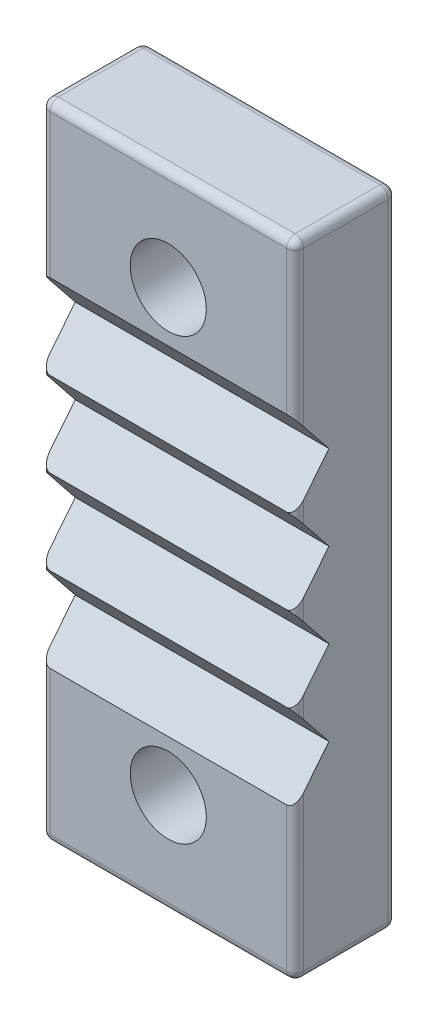
from build123d import *

# Parameters (mm, degrees)
SKETCH_1_W             = 15
SKETCH_1_H             = 38
SKETCH_1_R             = 2.25
EXTRUDE_1_DEPTH        = 3
FILLET_1_R             = 0.5
CUT_EXTRUDE_1_DEPTH    = 7.5
PATTERN_LINEAR_1_COUNT = 4
PATTERN_LINEAR_1_PITCH = 5


with BuildPart() as part:
    # 草图1 → 凸台-拉伸1 (new, symmetric)
    with BuildSketch(Plane.XY):
        Rectangle(SKETCH_1_W, SKETCH_1_H)
        with Locations((0, 13)):
            Circle(SKETCH_1_R, mode=Mode.SUBTRACT)
        with Locations((0, -13)):
            Circle(SKETCH_1_R, mode=Mode.SUBTRACT)
    extrude(amount=EXTRUDE_1_DEPTH, both=True)

    # 圆角1
    fillet_1_edges = [part.edges().sort_by_distance(p)[0] for p in [
        (-7.5, 0, 3),
        (0, -19, 3),
        (7.5, 0, 3),
        (0, -19, -3),
        (-7.5, 0, -3),
        (0, 19, -3),
        (7.5, 0, -3),
        (7.5, -19, 0),
        (-7.5, -19, 0),
        (-7.5, 19, 0),
        (7.5, 19, 0),
        (0, 19, 3),
    ]]
    fillet(fillet_1_edges, radius=FILLET_1_R)

    # 草图2 → 切除-拉伸1 (cut, symmetric)
    with BuildSketch(Plane(origin=(0, 0, 0), x_dir=(0, 0, -1), z_dir=(1, 0, 0))):
        Polygon((-3, 10), (-1, 7.5), (-3, 5), align=None)
    cut_extrude_1 = extrude(amount=CUT_EXTRUDE_1_DEPTH, both=True, mode=Mode.SUBTRACT)

    # 阵列(线性)1: 切除-拉伸1 ×4
    with Locations(*[(0, -i * PATTERN_LINEAR_1_PITCH, 0) for i in range(1, PATTERN_LINEAR_1_COUNT)]):
        add(cut_extrude_1, mode=Mode.SUBTRACT)


solid = part.part
